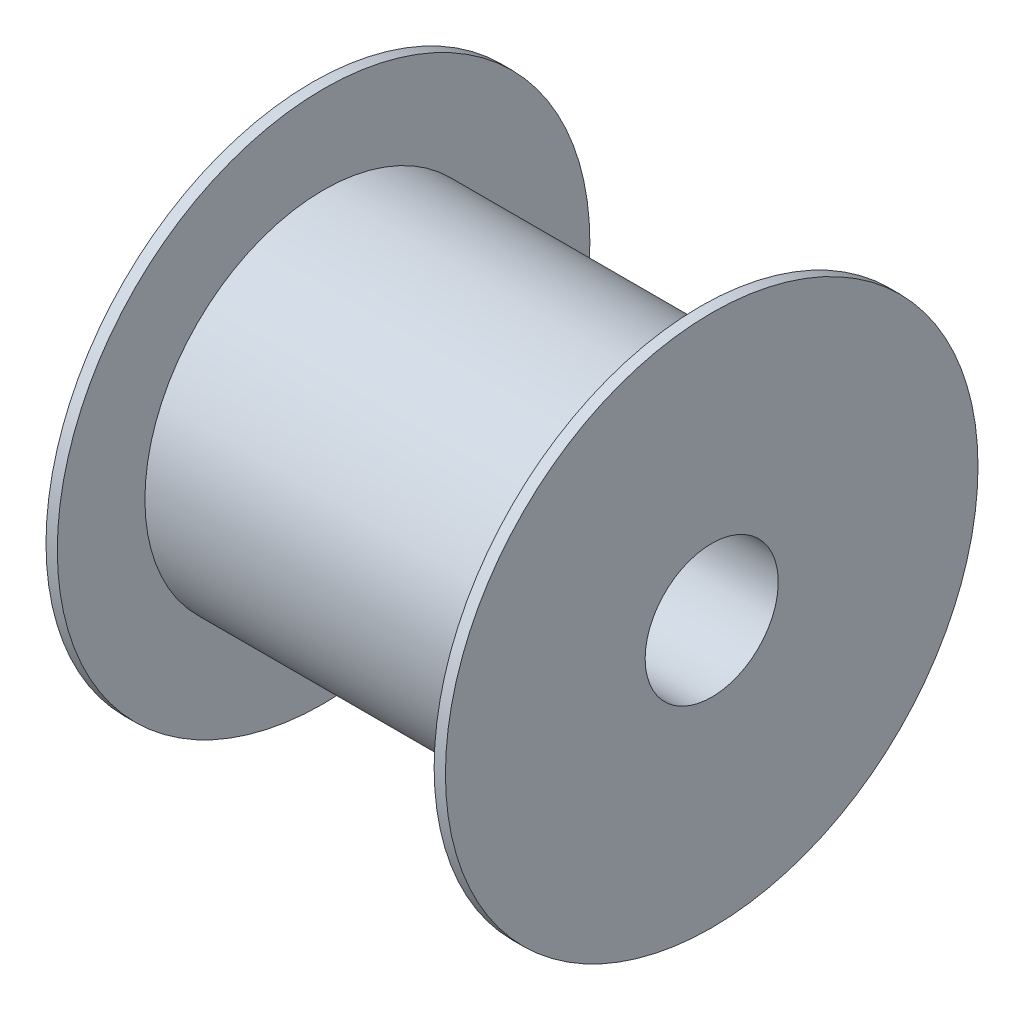
from build123d import *


with BuildPart() as part:
    # Sketch1 → Revolve1 (revolve)
    with BuildSketch(Plane.XY, mode=Mode.PRIVATE) as revolve1_sk:
        Polygon((-30, 10), (30, 10), (30, 40), (28.302872063, 40), (28.302872063, 26.84073107), (-28.302872063, 26.84073107), (-28.302872063, 40), (-30, 40), align=None)
    revolve(revolve1_sk.sketch.rotate(Axis((0, 0, 0), (1, 0, 0)), 90), axis=Axis((0, 0, 0), (1, 0, 0)))


solid = part.part
